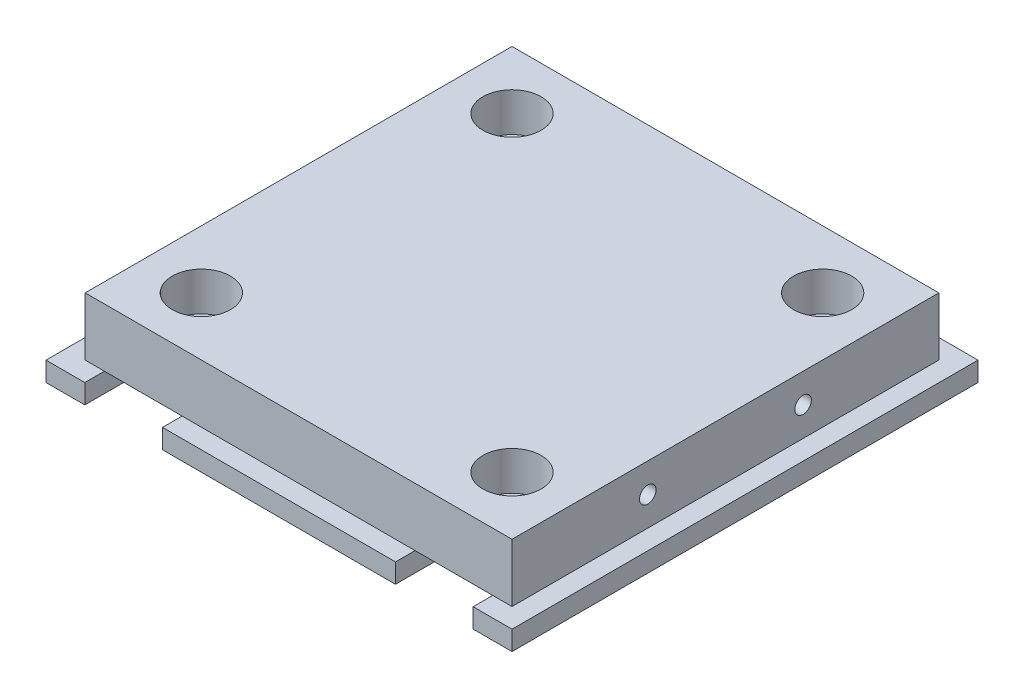
from build123d import *

# Parameters (mm, degrees)
SKETCH1_W           = 76.2
SKETCH1_H           = 76.2
BOSS_EXTRUDE1_DEPTH = 3.175
SKETCH2_W           = 69.79412
SKETCH2_H           = 69.79412
SKETCH2_W_2         = 57.09412
SKETCH2_H_2         = 57.09412
BOSS_EXTRUDE2_DEPTH = 9.525
SKETCH13_W          = 12.7
SKETCH13_H          = 76.2
CUT_EXTRUDE1_DEPTH  = 3.175
SKETCH15_R          = 2.5527
CUT_EXTRUDE2_DEPTH  = 55.716959208
SKETCH17_R          = 4.7625
CUT_EXTRUDE3_DEPTH  = 6.35


with BuildPart() as part:
    # Sketch1 → Boss-Extrude1 (new body)
    with BuildSketch(Plane(origin=(0, 0, 0), x_dir=(1, 0, 0), z_dir=(0, 1, 0))):
        Rectangle(SKETCH1_W, SKETCH1_H)
    extrude(amount=BOSS_EXTRUDE1_DEPTH)

    # Sketch2 → Boss-Extrude2 (add)
    # profile 1 of 2: a face of its own
    with BuildSketch(Plane(origin=(0, 3.175, 0), x_dir=(1, 0, 0), z_dir=(0, 1, 0))):
        Rectangle(SKETCH2_W, SKETCH2_H)
        Rectangle(SKETCH2_W_2, SKETCH2_H_2, mode=Mode.SUBTRACT)
    # profile 2 of 2: a face of its own
    with BuildSketch(Plane(origin=(0, 3.175, 0), x_dir=(1, 0, 0), z_dir=(0, 1, 0))):
        Rectangle(SKETCH2_W_2, SKETCH2_H_2)
    extrude(amount=BOSS_EXTRUDE2_DEPTH)

    # Sketch9 → #6-32 Tapped Hole2 (revolve, cut)
    with BuildSketch(Plane(origin=(34.89706, 7.9375, 12.7), x_dir=(0, 0, -1), z_dir=(0, 1, 0))):
        Polygon((0, 0), (0, 11.98869403), (1.35255, 11.176), (1.35255, 0), align=None)
    f_6_32_tapped_hole2 = revolve(axis=Axis((41.24706, 7.9375, 12.7), (-1, 0, 0)), mode=Mode.SUBTRACT)

    # Mirror1: #6-32 Tapped Hole2 across plane
    add(f_6_32_tapped_hole2.mirror(Plane.XY), mode=Mode.SUBTRACT)

    # Mirror2: #6-32 Tapped Hole2 across plane
    add(f_6_32_tapped_hole2.mirror(Plane(origin=(0, 0, 0), x_dir=(0, 0, 1), z_dir=(1, 0, 0))), mode=Mode.SUBTRACT)

    # Mirror2 copy 1 sketch → Mirror2 copy 1 (revolve, cut)
    with BuildSketch(Plane(origin=(-34.89706, 7.9375, -12.7), x_dir=(0, 0, 1), z_dir=(0, 1, 0))):
        Polygon((0, 0), (0, 11.98869403), (1.35255, 11.176), (1.35255, 0), align=None)
    revolve(axis=Axis((-41.24706, 7.9375, -12.7), (1, 0, 0)), mode=Mode.SUBTRACT)

    # Sketch13 → Cut-Extrude1 (cut)
    with BuildSketch(Plane.XZ):
        with Locations((-25.4, 0)):
            Rectangle(SKETCH13_W, SKETCH13_H)
        with Locations((25.4, 0)):
            Rectangle(SKETCH13_W, SKETCH13_H)
    extrude(amount=-CUT_EXTRUDE1_DEPTH, mode=Mode.SUBTRACT)

    # Sketch15 → Cut-Extrude2 (cut, through all)
    with BuildSketch(Plane.XZ.offset(-3.175)):
        with Locations(Location((-25.4, 25.4, 0), (0, 0, 270))):
            Circle(SKETCH15_R)
        with Locations(Location((25.4, 25.4, 0), (0, 0, 270))):
            Circle(SKETCH15_R)
        with Locations(Location((25.4, -25.4, 0), (0, 0, 270))):
            Circle(SKETCH15_R)
        with Locations(Location((-25.4, -25.4, 0), (0, 0, 270))):
            Circle(SKETCH15_R)
    extrude(amount=-CUT_EXTRUDE2_DEPTH, mode=Mode.SUBTRACT)

    # Sketch17 → Cut-Extrude3 (cut)
    with BuildSketch(Plane(origin=(0, 12.7, 0), x_dir=(1, 0, 0), z_dir=(0, 1, 0))):
        with Locations(Location((-25.4, 25.4, 0), (0, 0, 270))):
            Circle(SKETCH17_R)
        with Locations(Location((25.4, 25.4, 0), (0, 0, 270))):
            Circle(SKETCH17_R)
        with Locations(Location((25.4, -25.4, 0), (0, 0, 270))):
            Circle(SKETCH17_R)
        with Locations(Location((-25.4, -25.4, 0), (0, 0, 270))):
            Circle(SKETCH17_R)
    extrude(amount=-CUT_EXTRUDE3_DEPTH, mode=Mode.SUBTRACT)


solid = part.part
